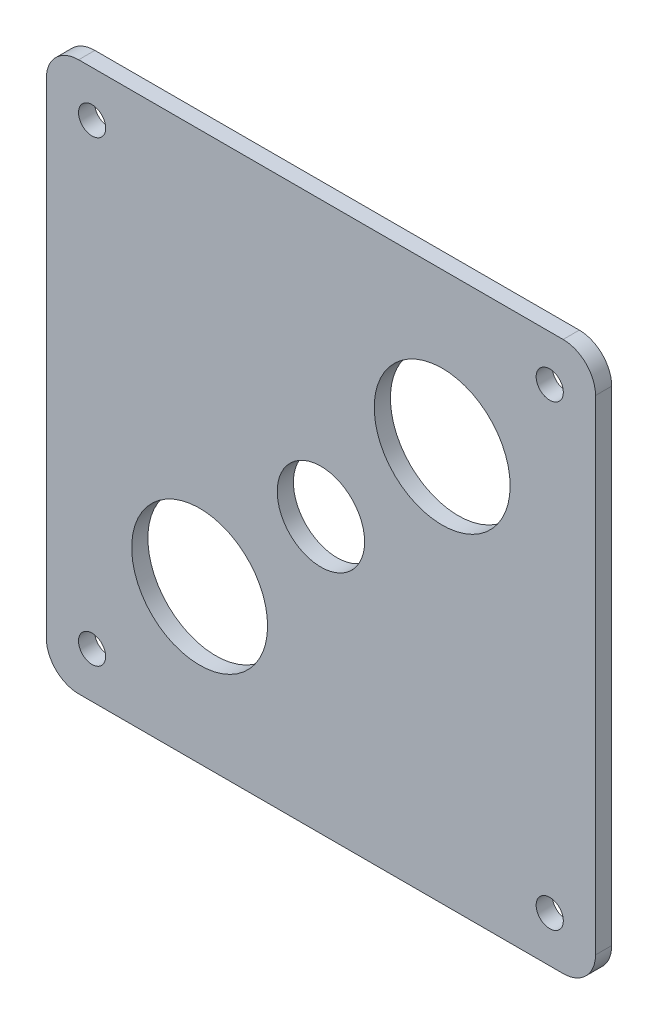
from build123d import *

# Parameters (mm, degrees)
SKETCH1_W           = 107.763073452
SKETCH1_H           = 107.763073452
BOSS_EXTRUDE1_DEPTH = 3.175
CUT_EXTRUDE2_REACH  = 78.266
SKETCH4_R           = 8.5725
FILLET2_R           = 6.35
CUT_EXTRUDE3_REACH  = 78.266
SKETCH5_R           = 2.665000004
CUT_EXTRUDE4_REACH  = 78.266
SKETCH6_R           = 13.335


with BuildPart() as part:
    # Sketch1 → Boss-Extrude1 (new body)
    with BuildSketch(Plane.XY):
        Rectangle(SKETCH1_W, SKETCH1_H)
    extrude(amount=BOSS_EXTRUDE1_DEPTH)

    # Sketch4 → Cut-Extrude2 (cut, up to next)
    with BuildSketch(Plane.XY.offset(3.175), mode=Mode.PRIVATE) as cut_extrude2_sk1:
        Circle(SKETCH4_R)
    cut_extrude2_tool1 = extrude(cut_extrude2_sk1.sketch, amount=-CUT_EXTRUDE2_REACH, mode=Mode.PRIVATE) & part.part
    add(cut_extrude2_tool1.solids().sort_by_distance((0, 0, 3.175))[0], mode=Mode.SUBTRACT)

    # Fillet2
    fillet2_edges = [part.edges().sort_by_distance(p)[0] for p in [
        (-53.881536726, -53.881536726, 1.5875),
        (-53.881536726, 53.881536726, 1.5875),
        (53.881536726, 53.881536726, 1.5875),
        (53.881536726, -53.881536726, 1.5875),
    ]]
    fillet(fillet2_edges, radius=FILLET2_R)

    # Sketch5 → Cut-Extrude3 (cut, up to next)
    with BuildSketch(Plane(origin=(0, 0, 0), x_dir=(-1, 0, 0), z_dir=(0, 0, -1)), mode=Mode.PRIVATE) as cut_extrude3_sk1:
        with Locations((44.901280605, 44.901280605)):
            Circle(SKETCH5_R)
    cut_extrude3_tool1 = extrude(cut_extrude3_sk1.sketch, amount=-CUT_EXTRUDE3_REACH, mode=Mode.PRIVATE) & part.part
    # Sketch5 → Cut-Extrude3 (cut, up to next)
    with BuildSketch(Plane(origin=(0, 0, 0), x_dir=(-1, 0, 0), z_dir=(0, 0, -1)), mode=Mode.PRIVATE) as cut_extrude3_sk2:
        with Locations((44.901280605, -44.901280605)):
            Circle(SKETCH5_R)
    cut_extrude3_tool2 = extrude(cut_extrude3_sk2.sketch, amount=-CUT_EXTRUDE3_REACH, mode=Mode.PRIVATE) & part.part
    # Sketch5 → Cut-Extrude3 (cut, up to next)
    with BuildSketch(Plane(origin=(0, 0, 0), x_dir=(-1, 0, 0), z_dir=(0, 0, -1)), mode=Mode.PRIVATE) as cut_extrude3_sk3:
        with Locations((-44.901280605, -44.901280605)):
            Circle(SKETCH5_R)
    cut_extrude3_tool3 = extrude(cut_extrude3_sk3.sketch, amount=-CUT_EXTRUDE3_REACH, mode=Mode.PRIVATE) & part.part
    # Sketch5 → Cut-Extrude3 (cut, up to next)
    with BuildSketch(Plane(origin=(0, 0, 0), x_dir=(-1, 0, 0), z_dir=(0, 0, -1)), mode=Mode.PRIVATE) as cut_extrude3_sk4:
        with Locations((-44.901280605, 44.901280605)):
            Circle(SKETCH5_R)
    cut_extrude3_tool4 = extrude(cut_extrude3_sk4.sketch, amount=-CUT_EXTRUDE3_REACH, mode=Mode.PRIVATE) & part.part
    add(cut_extrude3_tool1.solids().sort_by_distance((-44.901281, 44.901281, 0))[0], mode=Mode.SUBTRACT)
    add(cut_extrude3_tool2.solids().sort_by_distance((-44.901281, -44.901281, 0))[0], mode=Mode.SUBTRACT)
    add(cut_extrude3_tool3.solids().sort_by_distance((44.901281, -44.901281, 0))[0], mode=Mode.SUBTRACT)
    add(cut_extrude3_tool4.solids().sort_by_distance((44.901281, 44.901281, 0))[0], mode=Mode.SUBTRACT)

    # Sketch6 → Cut-Extrude4 (cut, up to next)
    with BuildSketch(Plane.XY.offset(3.175), mode=Mode.PRIVATE) as cut_extrude4_sk1:
        with Locations((23.797678721, 23.797678721)):
            Circle(SKETCH6_R)
    cut_extrude4_tool1 = extrude(cut_extrude4_sk1.sketch, amount=-CUT_EXTRUDE4_REACH, mode=Mode.PRIVATE) & part.part
    # Sketch6 → Cut-Extrude4 (cut, up to next)
    with BuildSketch(Plane.XY.offset(3.175), mode=Mode.PRIVATE) as cut_extrude4_sk2:
        with Locations((-23.797678721, -23.797678721)):
            Circle(SKETCH6_R)
    cut_extrude4_tool2 = extrude(cut_extrude4_sk2.sketch, amount=-CUT_EXTRUDE4_REACH, mode=Mode.PRIVATE) & part.part
    add(cut_extrude4_tool1.solids().sort_by_distance((23.797679, 23.797679, 3.175))[0], mode=Mode.SUBTRACT)
    add(cut_extrude4_tool2.solids().sort_by_distance((-23.797679, -23.797679, 3.175))[0], mode=Mode.SUBTRACT)


solid = part.part
